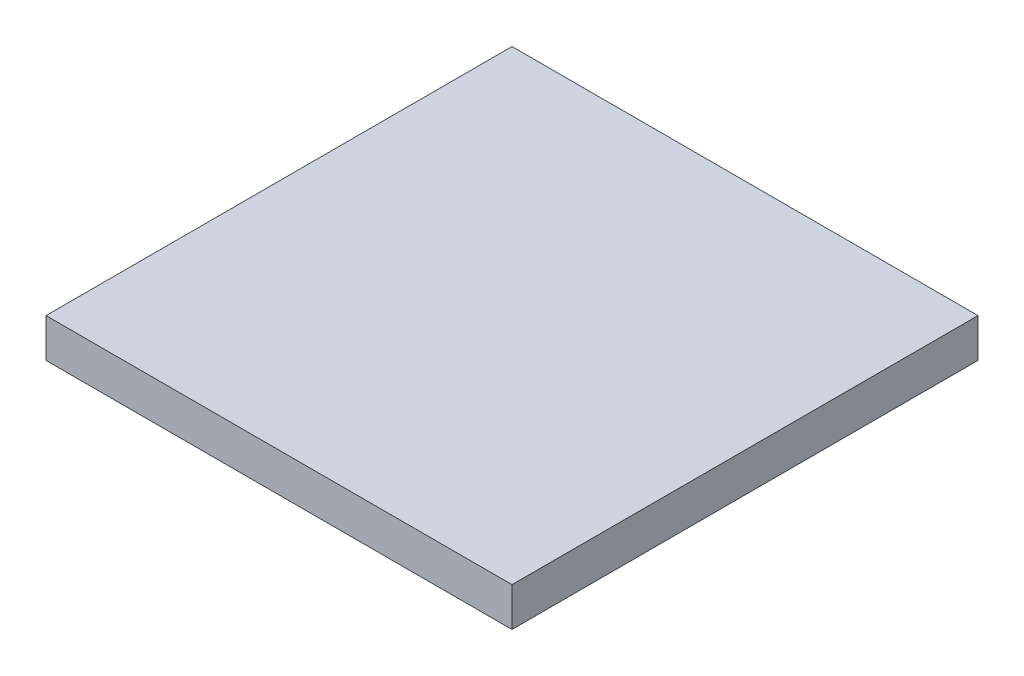
from build123d import *

# Parameters (mm, degrees)
SKETCH_1_W      = 6
SKETCH_1_H      = 6
EXTRUDE_2_DEPTH = 0.5


with BuildPart() as part:
    # 草图1 → 凸台-拉伸2 (new body)
    with BuildSketch(Plane(origin=(0, 0, 0), x_dir=(1, 0, 0), z_dir=(0, 1, 0))):
        with Locations((-0.213622291, -0.352941176)):
            Rectangle(SKETCH_1_W, SKETCH_1_H)
    extrude(amount=EXTRUDE_2_DEPTH)


solid = part.part
